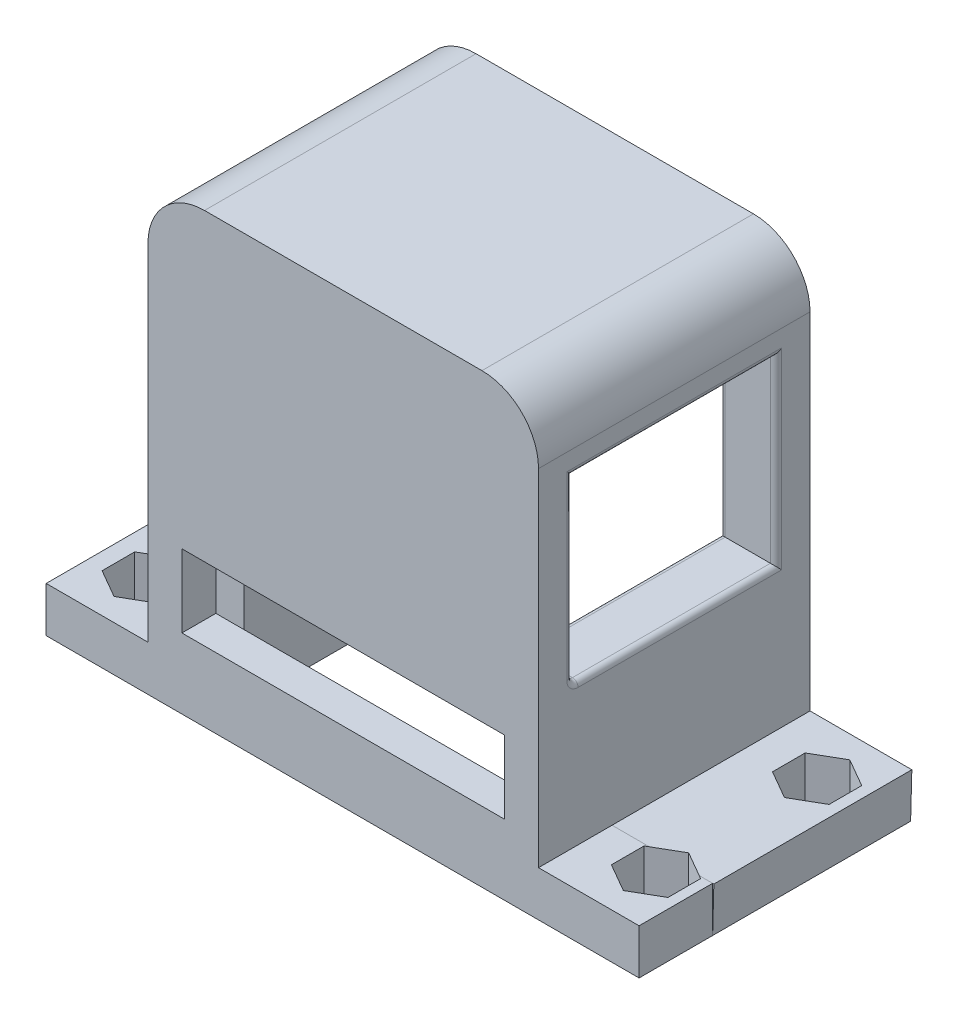
from build123d import *

# Parameters (mm, degrees)
BOSS_EXTRUDE1_DEPTH     = 17.5
BOSS_EXTRUDE2_DEPTH     = 6.5
SKETCH4_W               = 24.52025143
SKETCH4_H               = 35
CUT_EXTRUDE1_DEPTH      = 3.5
SKETCH5_W               = 23.62971737
SKETCH5_H               = 2
CUT_EXTRUDE2_DEPTH      = 4.5
FILLET1_R               = 5
SKETCH7_W               = 9
SKETCH7_H               = 4
SKETCH7_W_2             = 8.890538969
SKETCH7_H_2             = 3.998522236
BOSS_EXTRUDE3_DEPTH     = 6.5
FILLET2_R               = 1
CUT_EXTRUDE4_REACH      = 69.415
SKETCH8_W               = 18
SKETCH8_H               = 16
FILLET3_R               = 0.5
CUT_EXTRUDE5_REACH      = 69.415
SKETCH9_W               = 18
SKETCH9_H               = 16
FILLET4_R               = 0.5
SKETCH10_W              = 28.52025143
SKETCH10_H              = 6.445257338
CUT_EXTRUDE6_DEPTH      = 3
CUT_EXTRUDE7_DEPTH      = 10
CUT_EXTRUDE7_DEPTH_BACK = 68.853985243


with BuildPart() as part:
    # Sketch1 → Boss-Extrude1 (new body)
    with BuildSketch(Plane.XY):
        Polygon((0.056027157, 6.000000005), (14.056027157, 6.000000005), (14.056027157, 41.000000005), (38.576278587, 41.000000005), (38.576278587, 6.000000005), (52.466817556, 6.000000005), (52.576278587, 9.99850201), (43.576278587, 9.998522241), (43.576278587, 39.558678923), (43.576278587, 45.550000005), (41.466812647, 45.550000005), (38.316152872, 45.550000005), (14.316152872, 45.550000005), (9.056027157, 45.550000005), (9.056027157, 39.558678923), (9.056027157, 10.000000005), (0.056027157, 10.000000005), align=None)
    extrude(amount=BOSS_EXTRUDE1_DEPTH)

    # Sketch2 → Boss-Extrude2 (add)
    with BuildSketch(Plane.XY.offset(17.5)):
        Polygon((9.056027157, 10.000000005), (9.056027157, 45.550000005), (43.576278587, 45.550000005), (43.576278587, 6.000000005), (9.056027157, 6.000000005), align=None)
    extrude(amount=BOSS_EXTRUDE2_DEPTH)

    # Sketch4 → Cut-Extrude1 (cut)
    with BuildSketch(Plane(origin=(0, 0, 17.5), x_dir=(-1, 0, 0), z_dir=(0, 0, -1))):
        with Locations((-26.316152872, 23.500000005)):
            Rectangle(SKETCH4_W, SKETCH4_H)
    extrude(amount=-CUT_EXTRUDE1_DEPTH, mode=Mode.SUBTRACT)

    # Sketch5 → Cut-Extrude2 (cut)
    with BuildSketch(Plane(origin=(0, 0, 21), x_dir=(-1, 0, 0), z_dir=(0, 0, -1))):
        with Locations((-26.761419902, 42.000000005)):
            Rectangle(SKETCH5_W, SKETCH5_H)
    extrude(amount=CUT_EXTRUDE2_DEPTH, mode=Mode.SUBTRACT)

    # Fillet1
    fillet1_edges = [part.edges().sort_by_distance(p)[0] for p in [
        (9.056027157, 45.550000005, 12),
        (43.576278587, 45.550000005, 12),
    ]]
    fillet(fillet1_edges, radius=FILLET1_R)

    # Sketch7 → Boss-Extrude3 (add, through all)
    with BuildSketch(Plane.XY.offset(17.5)):
        with Locations((4.556027157, 8.000000005)):
            Rectangle(SKETCH7_W, SKETCH7_H)
        with Locations((48.021548072, 7.999261123)):
            Rectangle(SKETCH7_W_2, SKETCH7_H_2)
    extrude(amount=BOSS_EXTRUDE3_DEPTH)

    # Fillet2
    fillet2_edges = [part.edges().sort_by_distance(p)[0] for p in [
        (38.576278587, 23.500000005, 0),
        (14.056027157, 23.500000005, 0),
    ]]
    fillet(fillet2_edges, radius=FILLET2_R)

    # Sketch8 → Cut-Extrude4 (cut, up to next)
    with BuildSketch(Plane.ZY.offset(-9.056027157), mode=Mode.PRIVATE) as cut_extrude4_sk1:
        with Locations((12, 30.550000005)):
            Rectangle(SKETCH8_W, SKETCH8_H)
    cut_extrude4_tool1 = extrude(cut_extrude4_sk1.sketch, amount=-CUT_EXTRUDE4_REACH, mode=Mode.PRIVATE) & part.part
    add(cut_extrude4_tool1.solids().sort_by_distance((9.056027, 30.55, 12))[0], mode=Mode.SUBTRACT)

    # Fillet3
    fillet3_edges = [part.edges().sort_by_distance(p)[0] for p in [
        (14.056027157, 30.550000005, 3),
        (14.056027157, 22.550000005, 12),
        (11.556027157, 22.550000005, 21),
        (9.056027157, 30.550000005, 3),
        (9.056027157, 22.550000005, 12),
        (9.056027157, 30.550000005, 21),
        (9.056027157, 38.550000005, 12),
        (14.056027157, 14.275000005, 21),
    ]]
    fillet(fillet3_edges, radius=FILLET3_R)

    # Sketch9 → Cut-Extrude5 (cut, up to next)
    with BuildSketch(Plane(origin=(43.576278587, 0, 0), x_dir=(0, 0, -1), z_dir=(1, 0, 0)), mode=Mode.PRIVATE) as cut_extrude5_sk1:
        with Locations((-12, 30.550000005)):
            Rectangle(SKETCH9_W, SKETCH9_H)
    cut_extrude5_tool1 = extrude(cut_extrude5_sk1.sketch, amount=-CUT_EXTRUDE5_REACH, mode=Mode.PRIVATE) & part.part
    add(cut_extrude5_tool1.solids().sort_by_distance((43.576279, 30.55, 12))[0], mode=Mode.SUBTRACT)

    # Fillet4
    fillet4_edges = [part.edges().sort_by_distance(p)[0] for p in [
        (38.576278587, 14.275000005, 21),
        (38.576278587, 38.550000005, 12),
        (38.576278587, 30.550000005, 3),
        (38.576278587, 22.550000005, 12),
        (41.076278587, 22.550000005, 21),
        (43.576278587, 30.550000005, 21),
        (43.576278587, 22.550000005, 12),
        (43.576278587, 30.550000005, 3),
        (43.576278587, 38.550000005, 12),
    ]]
    fillet(fillet4_edges, radius=FILLET4_R)

    # Sketch10 → Cut-Extrude6 (cut)
    with BuildSketch(Plane.XY.offset(24)):
        with Locations((26.316152872, 15.429934293)):
            Rectangle(SKETCH10_W, SKETCH10_H)
    extrude(amount=-CUT_EXTRUDE6_DEPTH, mode=Mode.SUBTRACT)

    # Sketch6 → Cut-Extrude7 (cut, two sides: drawn at the far end of the back side and taken through both)
    with BuildSketch(Plane(origin=(2.2475e-05, 9.998620193, 0), x_dir=(0.9999999999974737, -2.2478262975890884e-06, 0), z_dir=(2.2478262975890884e-06, 0.9999999999974737, 0)).offset(-CUT_EXTRUDE7_DEPTH_BACK)):
        Polygon((4.056004679, -22), (6.556004679, -20.556624327), (6.556004679, -17.669872981), (4.056004679, -16.226497308), (1.556004679, -17.669872981), (1.556004679, -20.556624327), align=None)
        Polygon((1.556004679, -3.450509855), (4.056004679, -2.007134182), (6.556004679, -3.450509855), (6.556004679, -6.337261201), (4.056004679, -7.780636874), (1.556004679, -6.337261201), align=None)
        Polygon((46.576256112, -3.429667879), (49.076256112, -1.986292206), (51.576256112, -3.429667879), (51.576256112, -6.316419225), (49.076256112, -7.759794898), (46.576256112, -6.316419225), align=None)
        Polygon((49.076256112, -22), (51.576256112, -20.556624327), (51.576256112, -17.669872981), (49.076256112, -16.226497308), (46.576256112, -17.669872981), (46.576256112, -20.556624327), align=None)
    extrude(amount=CUT_EXTRUDE7_DEPTH + CUT_EXTRUDE7_DEPTH_BACK, mode=Mode.SUBTRACT)


solid = part.part
